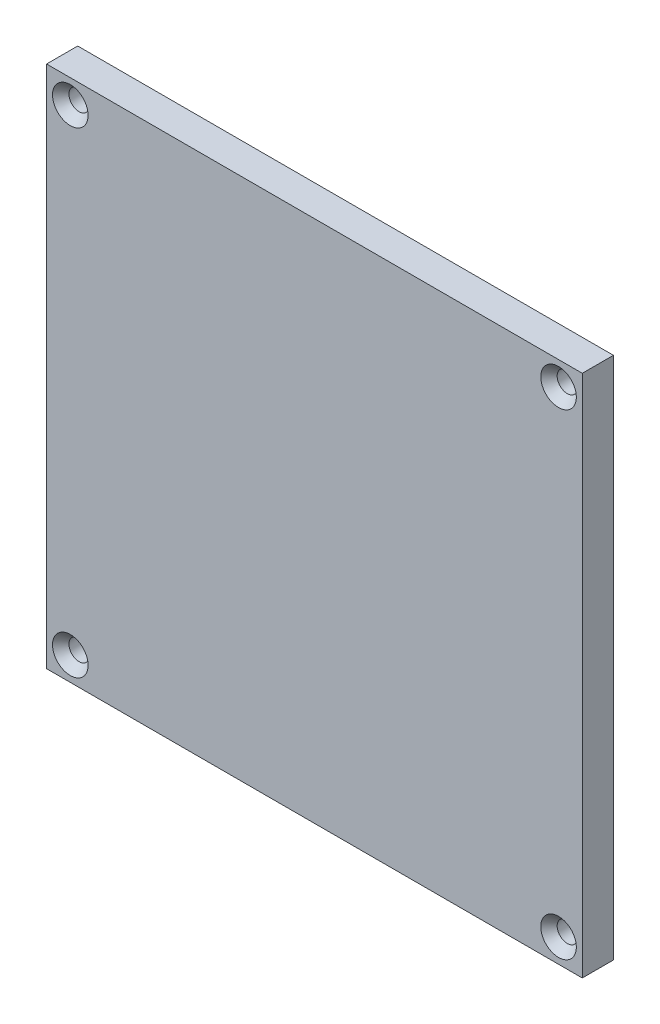
from build123d import *

# Parameters (mm, degrees)
SKETCH1_W                                      = 85.999999704
SKETCH1_H                                      = 84.074
BOSS_EXTRUDE1_DEPTH                            = 4.999999906
CSK_FOR_4_FLAT_HEAD_MACHINE_SCREW1_D           = 3.2639
CSK_FOR_4_FLAT_HEAD_MACHINE_SCREW1_CSINK_D     = 5.715
CSK_FOR_4_FLAT_HEAD_MACHINE_SCREW1_CSINK_ANGLE = 82


with BuildPart() as part:
    # Sketch1 → Boss-Extrude1 (new body)
    with BuildSketch(Plane.XY):
        Rectangle(SKETCH1_W, SKETCH1_H)
    extrude(amount=BOSS_EXTRUDE1_DEPTH)

    # CSK for #4 Flat Head Machine Screw1 (through all)
    with Locations(Plane.XY.offset(4.999999906)):
        with Locations((-39.189999852, 38.227), (39.189999852, 38.227), (-39.189999852, -38.227), (39.189999852, -38.227)):
            CounterSinkHole(CSK_FOR_4_FLAT_HEAD_MACHINE_SCREW1_D / 2, CSK_FOR_4_FLAT_HEAD_MACHINE_SCREW1_CSINK_D / 2, counter_sink_angle=CSK_FOR_4_FLAT_HEAD_MACHINE_SCREW1_CSINK_ANGLE)


solid = part.part
